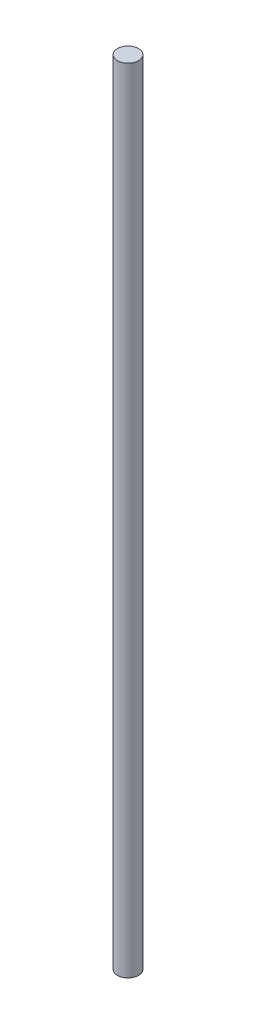
from build123d import *

# Parameters (mm, degrees)
SKETCH1_R           = 2
BOSS_EXTRUDE1_DEPTH = 150


with BuildPart() as part:
    # Sketch1 → Boss-Extrude1 (new body)
    with BuildSketch(Plane(origin=(0, 0, 0), x_dir=(1, 0, 0), z_dir=(0, 1, 0))):
        with Locations(Location((0, 0, 0), (0, 0, 270))):
            Circle(SKETCH1_R)
    extrude(amount=BOSS_EXTRUDE1_DEPTH)


solid = part.part
